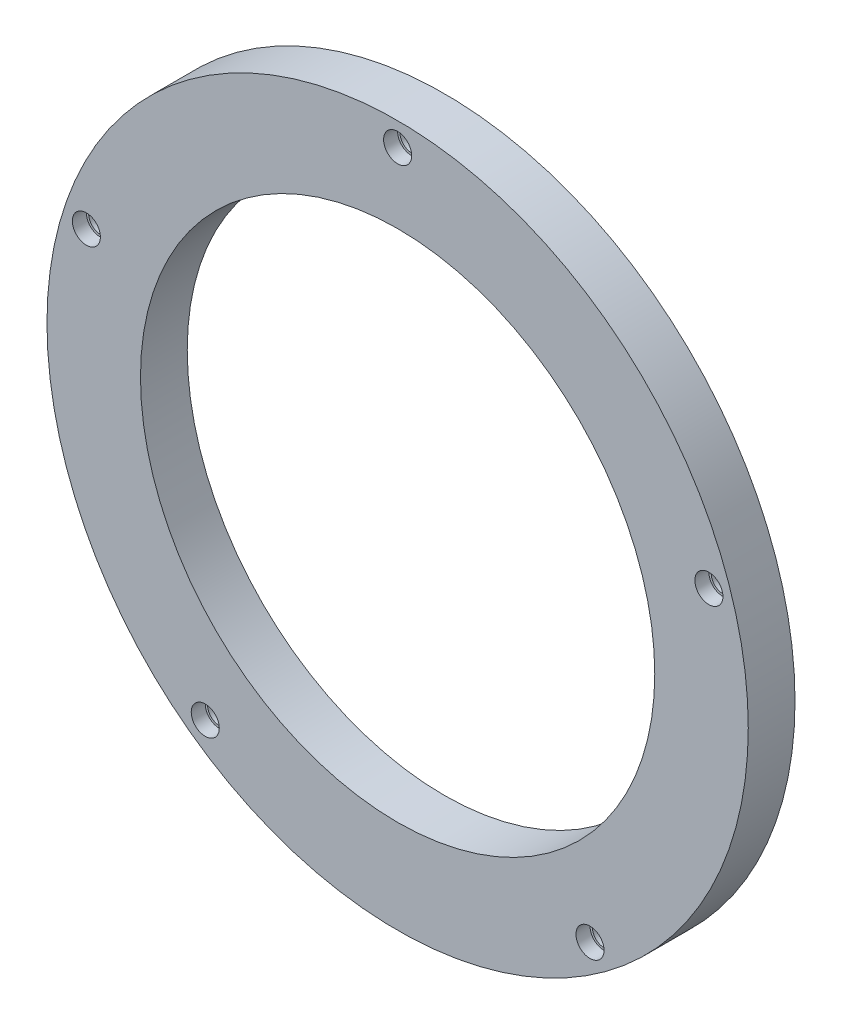
from build123d import *

# Parameters (mm, degrees)
SKETCH2_R           = 75
BOSS_EXTRUDE1_DEPTH = 10
SKETCH3_R           = 55
CUT_EXTRUDE1_DEPTH  = 10
SKETCH6_R           = 3
CUT_EXTRUDE2_DEPTH  = 3
SKETCH5_R           = 2.5
CUT_EXTRUDE3_DEPTH  = 107.536378763
CIRPATTERN2_COUNT   = 5


with BuildPart() as part:
    # Sketch2 → Boss-Extrude1 (new body)
    with BuildSketch(Plane(origin=(0, 0, 0), x_dir=(0, 1, 0), z_dir=(0, 0, 1))):
        with Locations(Location((0, 0, 0), (0, 0, 270))):
            Circle(SKETCH2_R)
    extrude(amount=BOSS_EXTRUDE1_DEPTH)

    # Sketch3 → Cut-Extrude1 (cut)
    with BuildSketch(Plane.XY.offset(10)):
        Circle(SKETCH3_R)
    extrude(amount=-CUT_EXTRUDE1_DEPTH, mode=Mode.SUBTRACT)

    # Sketch6 → Cut-Extrude2 (cut)
    with BuildSketch(Plane.XY.offset(10)):
        with Locations((0, 70)):
            Circle(SKETCH6_R)
    cut_extrude2 = extrude(amount=-CUT_EXTRUDE2_DEPTH, mode=Mode.SUBTRACT)

    # Sketch5 → Cut-Extrude3 (cut, through all)
    with BuildSketch(Plane.XY.offset(10)):
        with Locations((0, 70)):
            Circle(SKETCH5_R)
    cut_extrude3 = extrude(amount=-CUT_EXTRUDE3_DEPTH, mode=Mode.SUBTRACT)

    # CirPattern2: Cut-Extrude2, Cut-Extrude3 ×5 about axis
    cirpattern2_axis = Axis((0, 0, 0), (0, 0, 1))
    add([cut_extrude2.rotate(cirpattern2_axis, i * 360 / CIRPATTERN2_COUNT) for i in range(1, CIRPATTERN2_COUNT)], mode=Mode.SUBTRACT)
    add([cut_extrude3.rotate(cirpattern2_axis, i * 360 / CIRPATTERN2_COUNT) for i in range(1, CIRPATTERN2_COUNT)], mode=Mode.SUBTRACT)


solid = part.part
